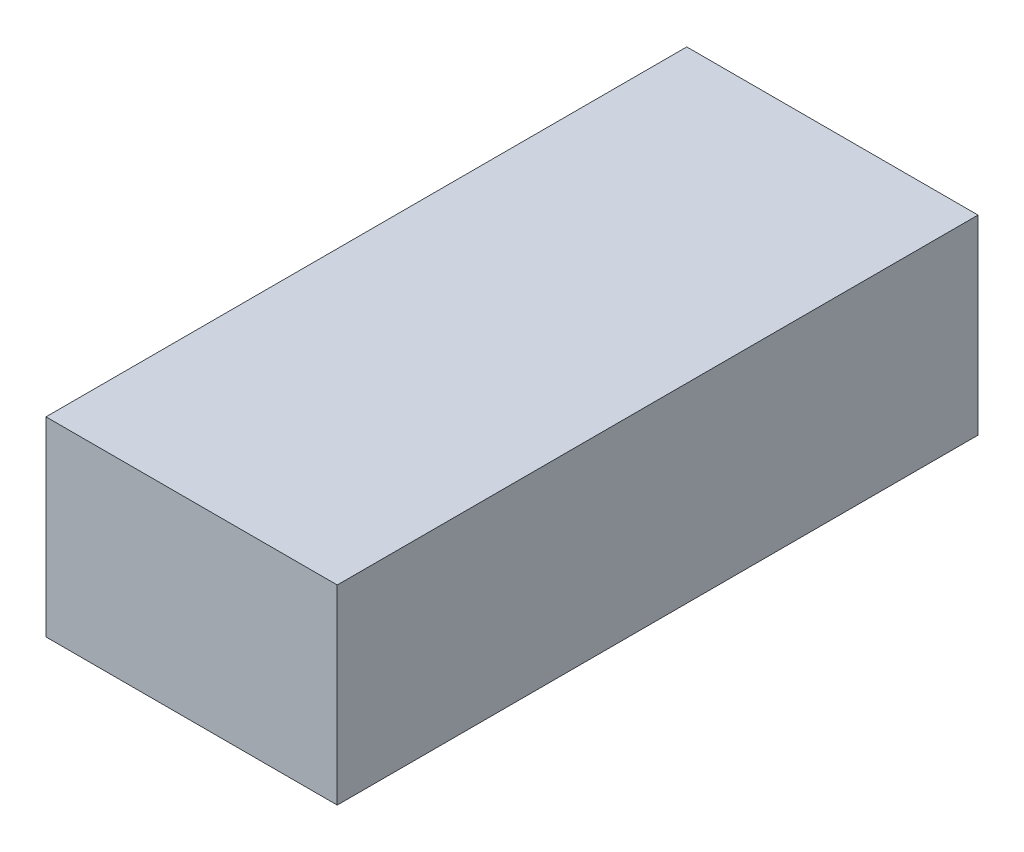
from build123d import *

# Parameters (mm, degrees)
SKETCH1_W           = 242
SKETCH1_H           = 72
BOSS_EXTRUDE1_DEPTH = 110
SHELL1_T            = -4


with BuildPart() as part:
    # Sketch1 → Boss-Extrude1 (new body)
    with BuildSketch(Plane(origin=(0, 0, 0), x_dir=(0, 0, -1), z_dir=(1, 0, 0))):
        Rectangle(SKETCH1_W, SKETCH1_H)
    extrude(amount=BOSS_EXTRUDE1_DEPTH)

    # Shell1
    shell1_openings = [part.faces().sort_by_distance(p)[0] for p in [
        (0, 0, 0),
    ]]
    offset(amount=SHELL1_T, openings=shell1_openings, kind=Kind.INTERSECTION)


solid = part.part
